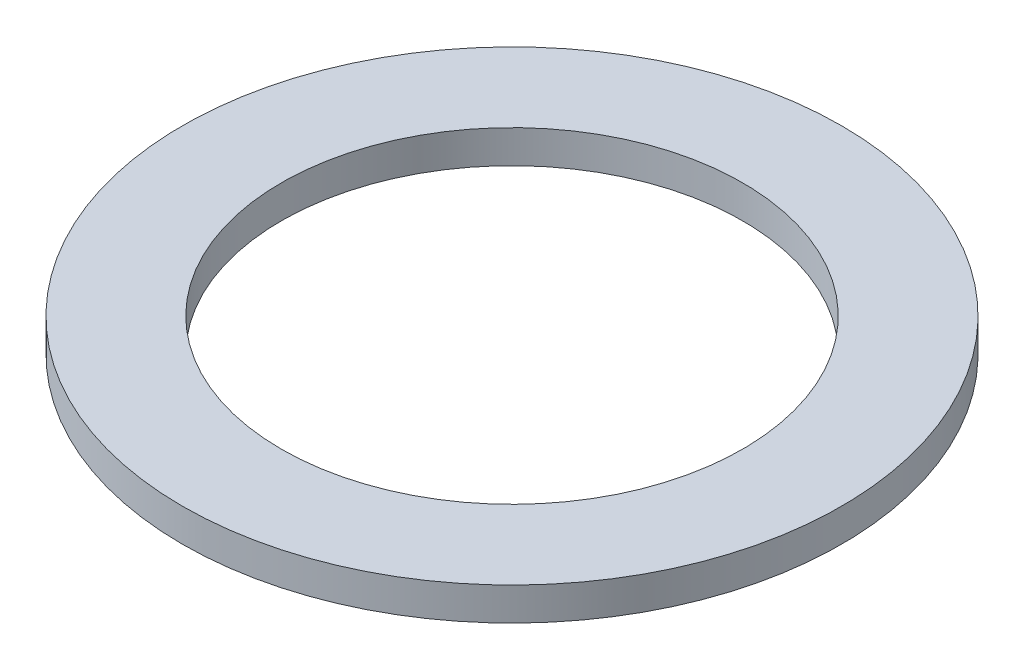
from build123d import *

# Parameters (mm, degrees)
SKETCH_1_R      = 10
SKETCH_1_R_2    = 7
EXTRUDE_1_DEPTH = 1


with BuildPart() as part:
    # 草图1 → 凸台-拉伸1 (new body)
    with BuildSketch(Plane(origin=(0, 0, 0), x_dir=(1, 0, 0), z_dir=(0, 1, 0))):
        with Locations(Location((0, 0, 0), (0, 0, 270))):
            Circle(SKETCH_1_R)
        with Locations(Location((0, 0, 0), (0, 0, 270))):
            Circle(SKETCH_1_R_2, mode=Mode.SUBTRACT)
    extrude(amount=EXTRUDE_1_DEPTH)


solid = part.part
